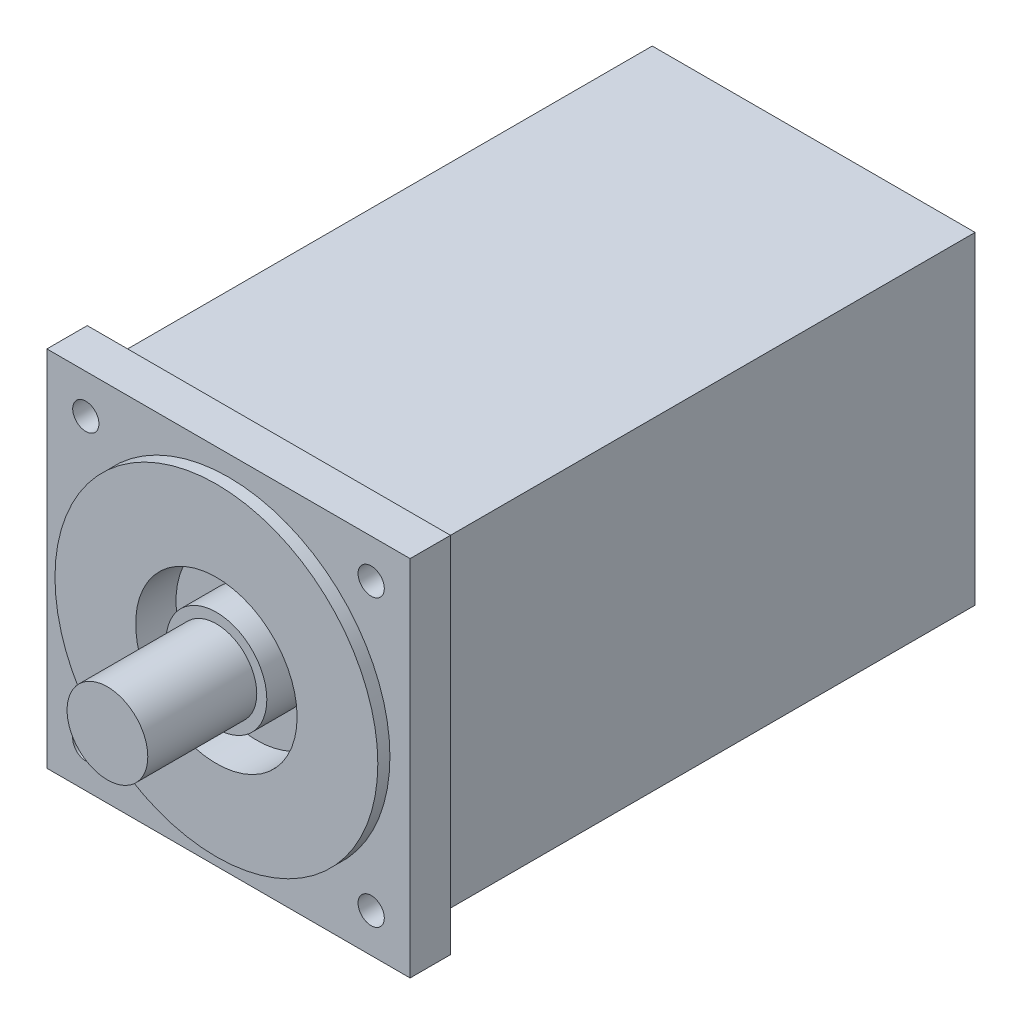
from build123d import *

# Parameters (mm, degrees)
SKETCH_1_W          = 80
SKETCH_1_H          = 80
EXTRUDE_1_DEPTH     = 134
SKETCH_2_R          = 40
EXTRUDE_2_DEPTH     = 1
SKETCH_3_W          = 90
SKETCH_3_H          = 90
EXTRUDE_3_DEPTH     = 10
SKETCH_4_R          = 40
EXTRUDE_4_DEPTH     = 3
SKETCH_5_R          = 20
CUT_EXTRUDE_1_DEPTH = 10
SKETCH_6_R          = 12.5
EXTRUDE_5_DEPTH     = 10
SKETCH_7_R          = 10
EXTRUDE_6_DEPTH     = 27
SKETCH_9_R          = 3.25
CUT_EXTRUDE_2_DEPTH = 10


with BuildPart() as part:
    # 草图1 → 拉伸1 (new body)
    with BuildSketch(Plane.XY):
        with Locations((40, -40)):
            Rectangle(SKETCH_1_W, SKETCH_1_H)
    extrude(amount=EXTRUDE_1_DEPTH)

    # 草图2 → 拉伸2 (add)
    with BuildSketch(Plane.XY.offset(134)):
        with Locations((40, -40)):
            Circle(SKETCH_2_R)
    extrude(amount=EXTRUDE_2_DEPTH)

    # 草图3 → 拉伸3 (add)
    with BuildSketch(Plane.XY.offset(135)):
        with Locations((40, -40)):
            Rectangle(SKETCH_3_W, SKETCH_3_H)
    extrude(amount=EXTRUDE_3_DEPTH)

    # 草图4 → 拉伸4 (add)
    with BuildSketch(Plane.XY.offset(145)):
        with Locations((40, -40)):
            Circle(SKETCH_4_R)
    extrude(amount=EXTRUDE_4_DEPTH)

    # 草图5 → 切除-拉伸1 (cut)
    with BuildSketch(Plane.XY.offset(148)):
        with Locations((40, -40)):
            Circle(SKETCH_5_R)
    extrude(amount=-CUT_EXTRUDE_1_DEPTH, mode=Mode.SUBTRACT)

    # 草图6 → 拉伸5 (add)
    with BuildSketch(Plane.XY.offset(138)):
        with Locations((40, -40)):
            Circle(SKETCH_6_R)
    extrude(amount=EXTRUDE_5_DEPTH)

    # 草图7 → 拉伸6 (add)
    with BuildSketch(Plane.XY.offset(148)):
        with Locations((40, -40)):
            Circle(SKETCH_7_R)
    extrude(amount=EXTRUDE_6_DEPTH)

    # 草图9 → 切除-拉伸2 (cut)
    with BuildSketch(Plane.XY.offset(145)):
        with Locations((75.355339059, -4.644660941)):
            Circle(SKETCH_9_R)
        with Locations((75.355339059, -75.355339059)):
            Circle(SKETCH_9_R)
        with Locations((4.644660941, -75.355339059)):
            Circle(SKETCH_9_R)
        with Locations((4.644660941, -4.644660941)):
            Circle(SKETCH_9_R)
    extrude(amount=-CUT_EXTRUDE_2_DEPTH, mode=Mode.SUBTRACT)


solid = part.part
